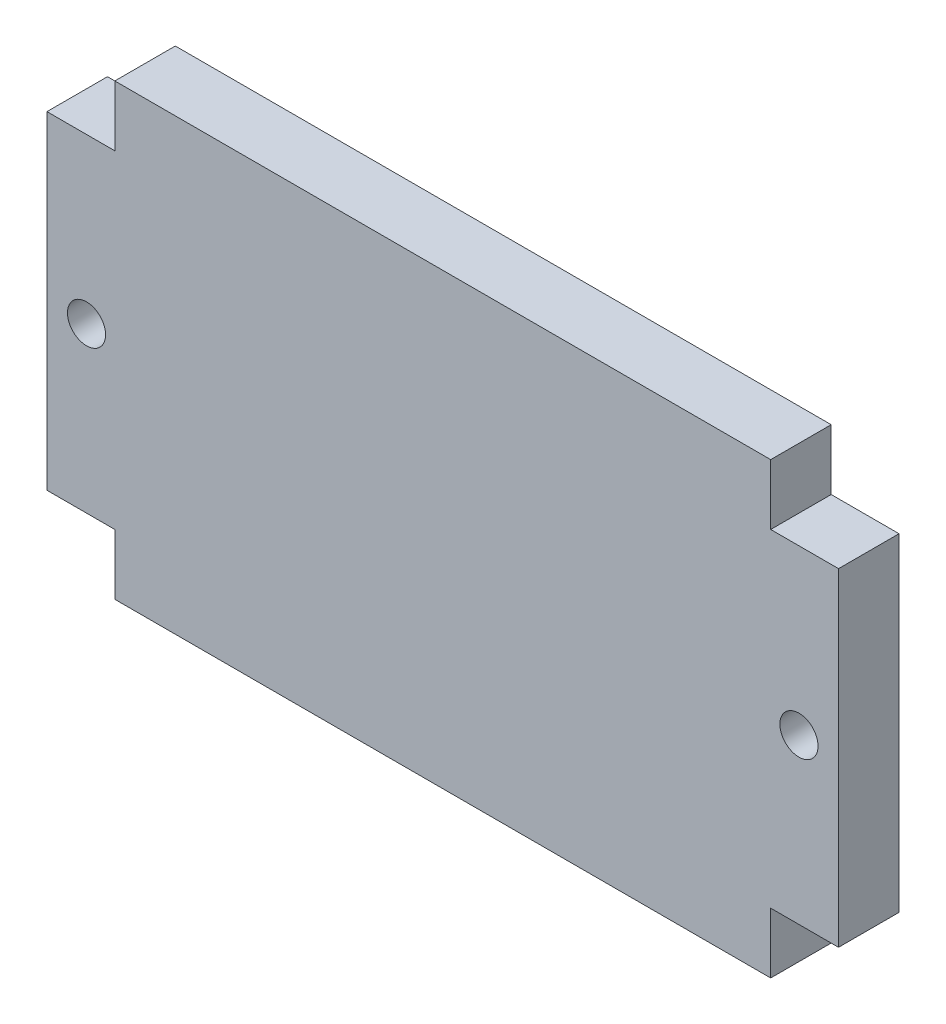
from build123d import *

# Parameters (mm, degrees)
MODEL_R             = 1.685
BOSS_EXTRUDE1_DEPTH = 5.35


with BuildPart() as part:
    # Model → Boss-Extrude1 (new body)
    with BuildSketch(Plane.XY):
        Polygon((5.999997258, 5.350001156), (5.999997258, 0), (64.000000246, 0), (64.000000246, 5.350001156), (70.000000298, 5.350001156), (70.000000298, 34.350000322), (64.000000246, 34.350000322), (64.000000246, 39.700000547), (5.999997258, 39.700000547), (5.999997258, 34.350000322), (0, 34.350000322), (0, 5.350001156), align=None)
        with Locations((66.500000298, 19.850000322)):
            Circle(MODEL_R, mode=Mode.SUBTRACT)
        with Locations((3.500000298, 19.850000322)):
            Circle(MODEL_R, mode=Mode.SUBTRACT)
    extrude(amount=BOSS_EXTRUDE1_DEPTH)


solid = part.part
